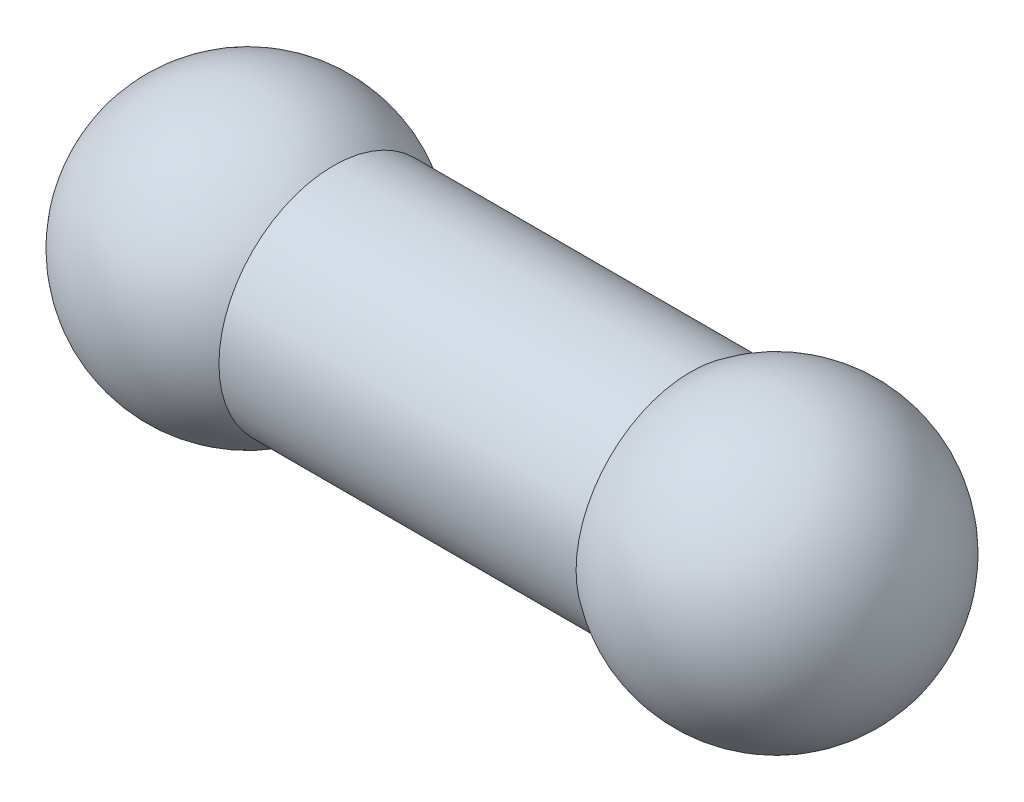
from build123d import *


with BuildPart() as part:
    # Çizim3 → Döndür2 (revolve)
    with BuildSketch(Plane.XY):
        with BuildLine():
            Line((-18.824555393, 4.808326112), (-3.824555393, 4.808326112))
            ThreePointArc((-3.824555393, 4.808326112), (2.453811589, 5.363451787), (5.764316296, 0))
            Line((5.764316296, 0), (-28.413427082, 0))
            ThreePointArc((-28.413427082, 0), (-25.102922375, 5.363451787), (-18.824555393, 4.808326112))
        make_face()
    revolve(axis=Axis((-28.413427082, 0, 0), (1, 0, 0)))


solid = part.part
